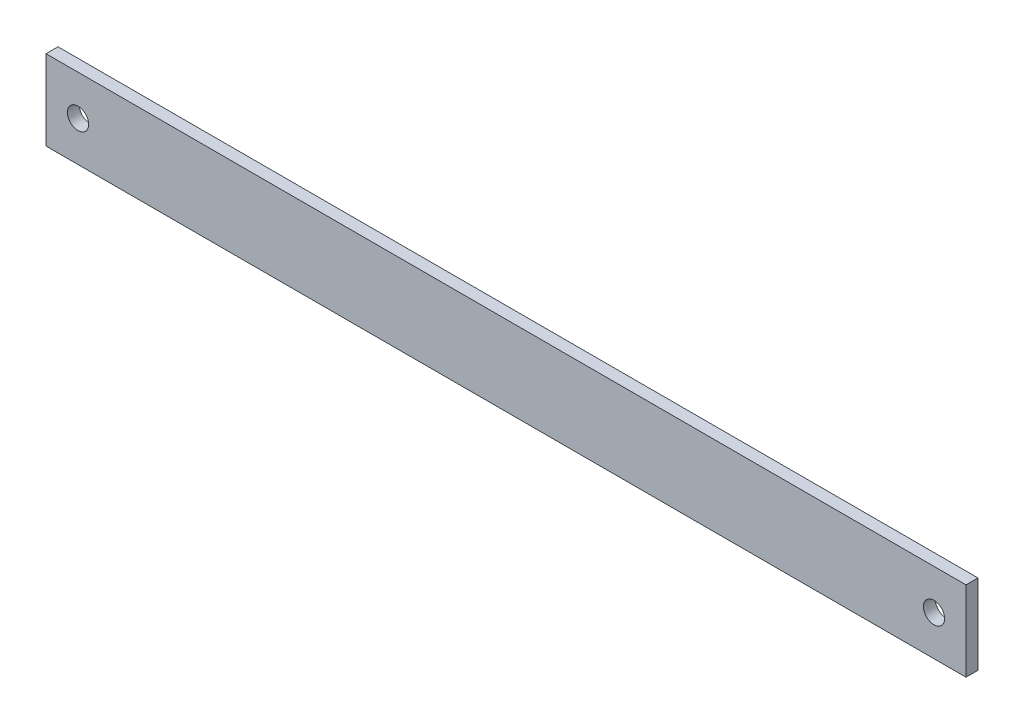
from build123d import *

# Parameters (mm, degrees)
EXTRUSION_BASE_SKETCH_W      = 230
EXTRUSION_BASE_SKETCH_H      = 20
EXTRUSION_BASE_SKETCH_R      = 2.65
EXTRUSION_BASE_EXTRUDE_DEPTH = 3


with BuildPart() as part:
    # Extrusion Base Sketch → Extrusion Base Extrude (new body)
    with BuildSketch(Plane.XY):
        with Locations((93.75, 7.5)):
            Rectangle(EXTRUSION_BASE_SKETCH_W, EXTRUSION_BASE_SKETCH_H)
        with Locations((-13.25, 7.5)):
            Circle(EXTRUSION_BASE_SKETCH_R, mode=Mode.SUBTRACT)
        with Locations((200.75, 7.5)):
            Circle(EXTRUSION_BASE_SKETCH_R, mode=Mode.SUBTRACT)
    extrude(amount=-EXTRUSION_BASE_EXTRUDE_DEPTH)


solid = part.part
